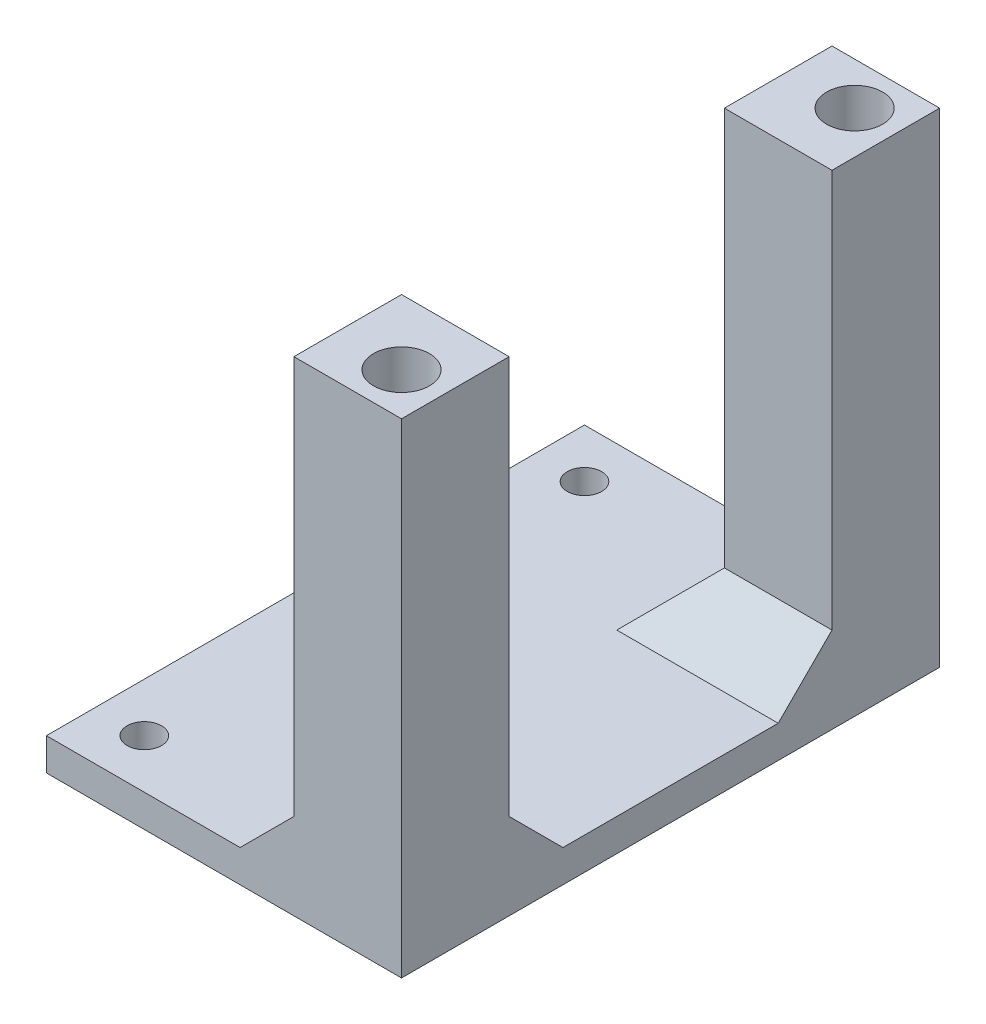
from build123d import *

# Parameters (mm, degrees)
SKETCH1_R           = 1.6
BOSS_EXTRUDE1_DEPTH = 3
SKETCH2_W           = 10
SKETCH2_H           = 10
BOSS_EXTRUDE2_DEPTH = 42
CHAMFER1_SIZE       = 5
SKETCH3_R           = 2.6
CUT_EXTRUDE1_DEPTH  = 52


with BuildPart() as part:
    # Sketch1 → Boss-Extrude1 (new body)
    with BuildSketch(Plane(origin=(0, 0, 0), x_dir=(1, 0, 0), z_dir=(0, 1, 0))):
        Polygon((-6.512396694, 9.685950413), (1.487603306, 9.685950413), (26.487603306, 9.685950413), (26.487603306, -40.314049587), (1.487603306, -40.314049587), (-6.512396694, -40.314049587), align=None)
        with Locations(Location((-1.962396694, -35.764049587, 0), (0, 0, 270))):
            Circle(SKETCH1_R, mode=Mode.SUBTRACT)
        with Locations(Location((-1.962396694, 5.135950413, 0), (0, 0, 270))):
            Circle(SKETCH1_R, mode=Mode.SUBTRACT)
    extrude(amount=BOSS_EXTRUDE1_DEPTH)

    # Sketch2 → Boss-Extrude2 (add)
    with BuildSketch(Plane(origin=(0, 3, 0), x_dir=(1, 0, 0), z_dir=(0, 1, 0))):
        with Locations((21.487603306, -35.314049587)):
            Rectangle(SKETCH2_W, SKETCH2_H)
        with Locations((21.487603306, 4.685950413)):
            Rectangle(SKETCH2_W, SKETCH2_H)
    extrude(amount=BOSS_EXTRUDE2_DEPTH)

    # Chamfer1
    chamfer1_edges = [part.edges().sort_by_distance(p)[0] for p in [
        (21.487603306, 3, 30.314049587),
        (16.487603306, 3, 35.314049587),
        (16.487603306, 3, -4.685950413),
        (21.487603306, 3, 0.314049587),
    ]]
    chamfer(chamfer1_edges, length=CHAMFER1_SIZE)

    # Sketch3 → Cut-Extrude1 (cut)
    with BuildSketch(Plane(origin=(0, 45, 0), x_dir=(1, 0, 0), z_dir=(0, 1, 0))):
        with Locations(Location((22.537603306, -36.364049587, 0), (0, 0, 270))):
            Circle(SKETCH3_R)
        with Locations(Location((22.537603306, 5.735950413, 0), (0, 0, 270))):
            Circle(SKETCH3_R)
    extrude(amount=-CUT_EXTRUDE1_DEPTH, mode=Mode.SUBTRACT)


solid = part.part
